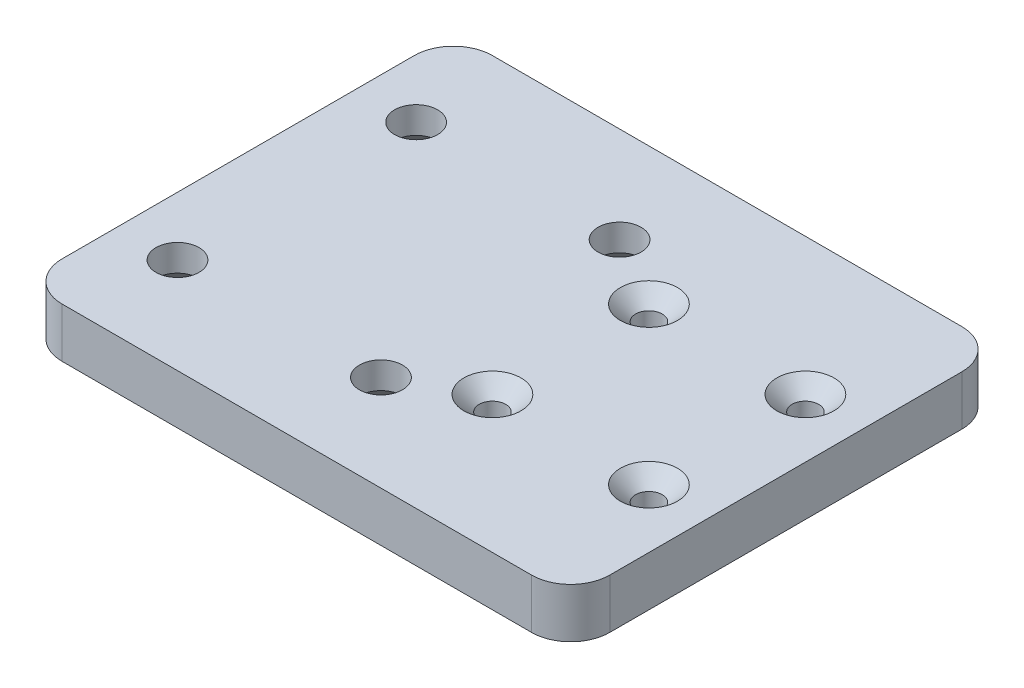
from build123d import *

# Parameters (mm, degrees)
SKETCH1_W                                       = 70
SKETCH1_H                                       = 55
BOSS_EXTRUDE1_DEPTH                             = 6.35
CUT_EXTRUDE1_START                              = 6.35
SKETCH1_3_R                                     = 1
CUT_EXTRUDE1_DEPTH                              = 6.35
CSK_FOR_M3_FLAT_HEAD_MACHINE_SCREW1_D           = 3.4
CSK_FOR_M3_FLAT_HEAD_MACHINE_SCREW1_CSINK_D     = 7.3
CSK_FOR_M3_FLAT_HEAD_MACHINE_SCREW1_CSINK_ANGLE = 90
FILLET1_R                                       = 5
CSK_FOR_M5_FLAT_HEAD_MACHINE_SCREW2_D           = 5.5
CSK_FOR_M5_FLAT_HEAD_MACHINE_SCREW2_CSINK_D     = 11.4
CSK_FOR_M5_FLAT_HEAD_MACHINE_SCREW2_CSINK_ANGLE = 90


with BuildPart() as part:
    # Sketch1 → Boss-Extrude1 (new body)
    with BuildSketch(Plane(origin=(0, 0, 0), x_dir=(1, 0, 0), z_dir=(0, 1, 0))):
        with Locations((2.711596357, 0)):
            Rectangle(SKETCH1_W, SKETCH1_H)
    extrude(amount=BOSS_EXTRUDE1_DEPTH)

    # Sketch1<3> → Cut-Extrude1 (cut)
    with BuildSketch(Plane(origin=(0, 0, 0), x_dir=(1, 0, 0), z_dir=(0, 1, 0)).offset(CUT_EXTRUDE1_START)):
        with Locations(Location((30.211596357, -10, 0), (0, 0, 90))):
            Circle(SKETCH1_3_R)
        with Locations(Location((10.211596357, -10, 0), (0, 0, 90))):
            Circle(SKETCH1_3_R)
        with Locations(Location((30.211596357, 10, 0), (0, 0, 90))):
            Circle(SKETCH1_3_R)
        with Locations(Location((10.211596357, 10, 0), (0, 0, 90))):
            Circle(SKETCH1_3_R)
        with Locations(Location((1.211596357, -15.25, 0), (0, 0, 90))):
            Circle(SKETCH1_3_R)
        with Locations(Location((-24.788403643, -15.25, 0), (0, 0, 90))):
            Circle(SKETCH1_3_R)
        with Locations(Location((1.211596357, 15.25, 0), (0, 0, 90))):
            Circle(SKETCH1_3_R)
        with Locations(Location((-24.788403643, 15.25, 0), (0, 0, 90))):
            Circle(SKETCH1_3_R)
    extrude(amount=-CUT_EXTRUDE1_DEPTH, mode=Mode.SUBTRACT)

    # CSK for M3 Flat Head Machine Screw1 (through all)
    with Locations(Plane(origin=(0, 6.35, 0), x_dir=(1, 0, 0), z_dir=(0, 1, 0))):
        with Locations((30.211596357, -10), (10.211596357, -10), (10.211596357, 10), (30.211596357, 10)):
            CounterSinkHole(CSK_FOR_M3_FLAT_HEAD_MACHINE_SCREW1_D / 2, CSK_FOR_M3_FLAT_HEAD_MACHINE_SCREW1_CSINK_D / 2, counter_sink_angle=CSK_FOR_M3_FLAT_HEAD_MACHINE_SCREW1_CSINK_ANGLE)

    # Fillet1
    fillet1_edges = [part.edges().sort_by_distance(p)[0] for p in [
        (37.711596357, 3.175, 27.5),
        (37.711596357, 3.175, -27.5),
        (-32.288403643, 3.175, -27.5),
        (-32.288403643, 3.175, 27.5),
    ]]
    fillet(fillet1_edges, radius=FILLET1_R)

    # CSK for M5 Flat Head Machine Screw2 (through all)
    with Locations(Plane(origin=(0, 0, 0), x_dir=(-1, 0, 0), z_dir=(0, -1, 0))):
        with Locations((24.788403643, -15.25), (24.788403643, 15.25), (-1.211596357, 15.25), (-1.211596357, -15.25)):
            CounterSinkHole(CSK_FOR_M5_FLAT_HEAD_MACHINE_SCREW2_D / 2, CSK_FOR_M5_FLAT_HEAD_MACHINE_SCREW2_CSINK_D / 2, counter_sink_angle=CSK_FOR_M5_FLAT_HEAD_MACHINE_SCREW2_CSINK_ANGLE)


solid = part.part
